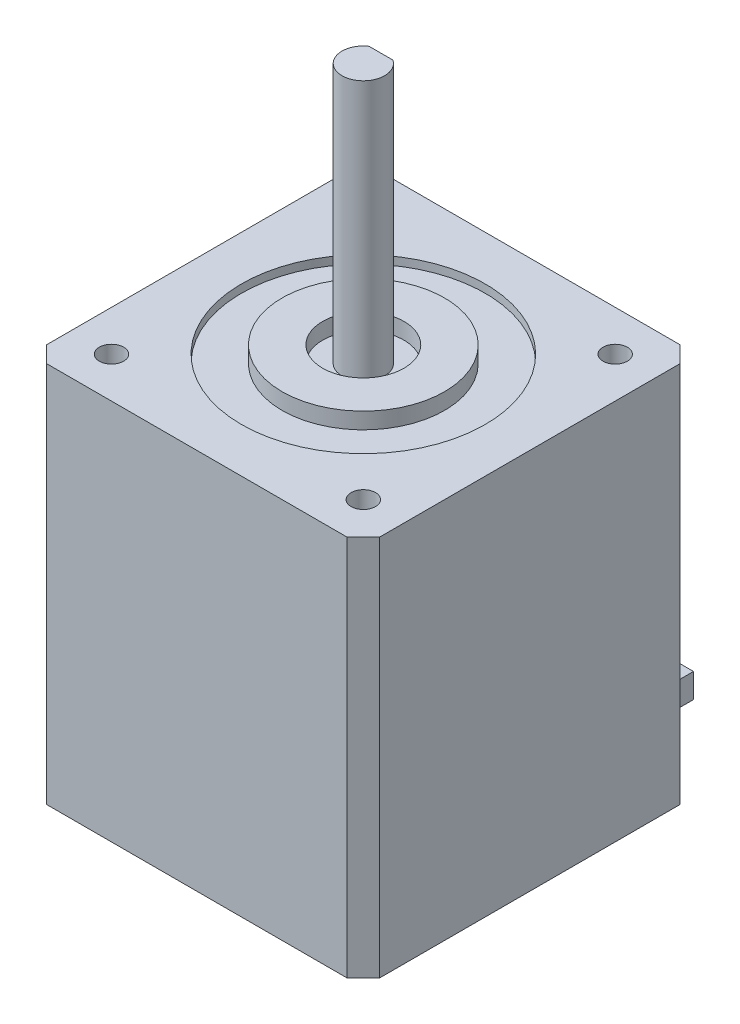
from build123d import *

# Parameters (mm, degrees)
BOSS_EXTRUDE1_DEPTH          = 47
SKETCH2_R                    = 15
CUT_EXTRUDE1_DEPTH           = 1
SKETCH3_R                    = 10
SKETCH3_R_2                  = 5
BOSS_EXTRUDE2_DEPTH          = 2
BOSS_EXTRUDE3_DEPTH          = 32
F_3_0_3_DIAMETER_HOLE1_D     = 3
F_3_0_3_DIAMETER_HOLE1_DEPTH = 5
F_3_0_3_DIAMETER_HOLE1_TIP   = 0.901290929
SKETCH7_W                    = 20
SKETCH7_H                    = 3
BOSS_EXTRUDE4_DEPTH          = 10


with BuildPart() as part:
    # Sketch1 → Boss-Extrude1 (new body)
    with BuildSketch(Plane(origin=(0, 0, 0), x_dir=(1, 0, 0), z_dir=(0, 1, 0))):
        Polygon((-20.5, 18.5), (-18.5, 20.5), (18.5, 20.5), (20.5, 18.5), (20.5, -18.5), (18.5, -20.5), (-18.5, -20.5), (-20.5, -18.5), align=None)
    extrude(amount=BOSS_EXTRUDE1_DEPTH)

    # Sketch2 → Cut-Extrude1 (cut)
    with BuildSketch(Plane(origin=(0, 47, 0), x_dir=(-1, 0, 0), z_dir=(0, 1, 0))):
        Circle(SKETCH2_R)
    extrude(amount=-CUT_EXTRUDE1_DEPTH, mode=Mode.SUBTRACT)

    # Sketch3 → Boss-Extrude2 (add)
    with BuildSketch(Plane(origin=(0, 46, 0), x_dir=(1, 0, 0), z_dir=(0, 1, 0))):
        Circle(SKETCH3_R)
        Circle(SKETCH3_R_2, mode=Mode.SUBTRACT)
    extrude(amount=BOSS_EXTRUDE2_DEPTH)

    # Sketch4 → Boss-Extrude3 (add)
    with BuildSketch(Plane(origin=(0, 46, 0), x_dir=(1, 0, 0), z_dir=(0, 1, 0))):
        with BuildLine():
            Line((-1.470984161, 2.175359116), (1.470984161, 2.175359116))
            ThreePointArc((1.470984161, 2.175359116), (0, -2.626020123), (-1.470984161, 2.175359116))
        make_face()
    extrude(amount=BOSS_EXTRUDE3_DEPTH)

    # Ø3.0 (3) Diameter Hole1
    with Locations(Plane(origin=(0, 47, 0), x_dir=(-1, 0, 0), z_dir=(0, 1, 0))):
        with Locations((-15.5, -15.5), (15.5, -15.5), (15.5, 15.5), (-15.5, 15.5)):
            Hole(F_3_0_3_DIAMETER_HOLE1_D / 2, depth=F_3_0_3_DIAMETER_HOLE1_DEPTH)
            with Locations((0, 0, -(F_3_0_3_DIAMETER_HOLE1_DEPTH + F_3_0_3_DIAMETER_HOLE1_TIP / 2))):  # 118° drill point
                Cone(0, F_3_0_3_DIAMETER_HOLE1_D / 2, F_3_0_3_DIAMETER_HOLE1_TIP, mode=Mode.SUBTRACT)

    # Sketch7 → Boss-Extrude4 (add)
    with BuildSketch(Plane(origin=(0, 0, -20.5), x_dir=(-1, 0, 0), z_dir=(0, 0, -1))):
        with Locations((-0.141546157, 1.5)):
            Rectangle(SKETCH7_W, SKETCH7_H)
    extrude(amount=BOSS_EXTRUDE4_DEPTH)


solid = part.part
